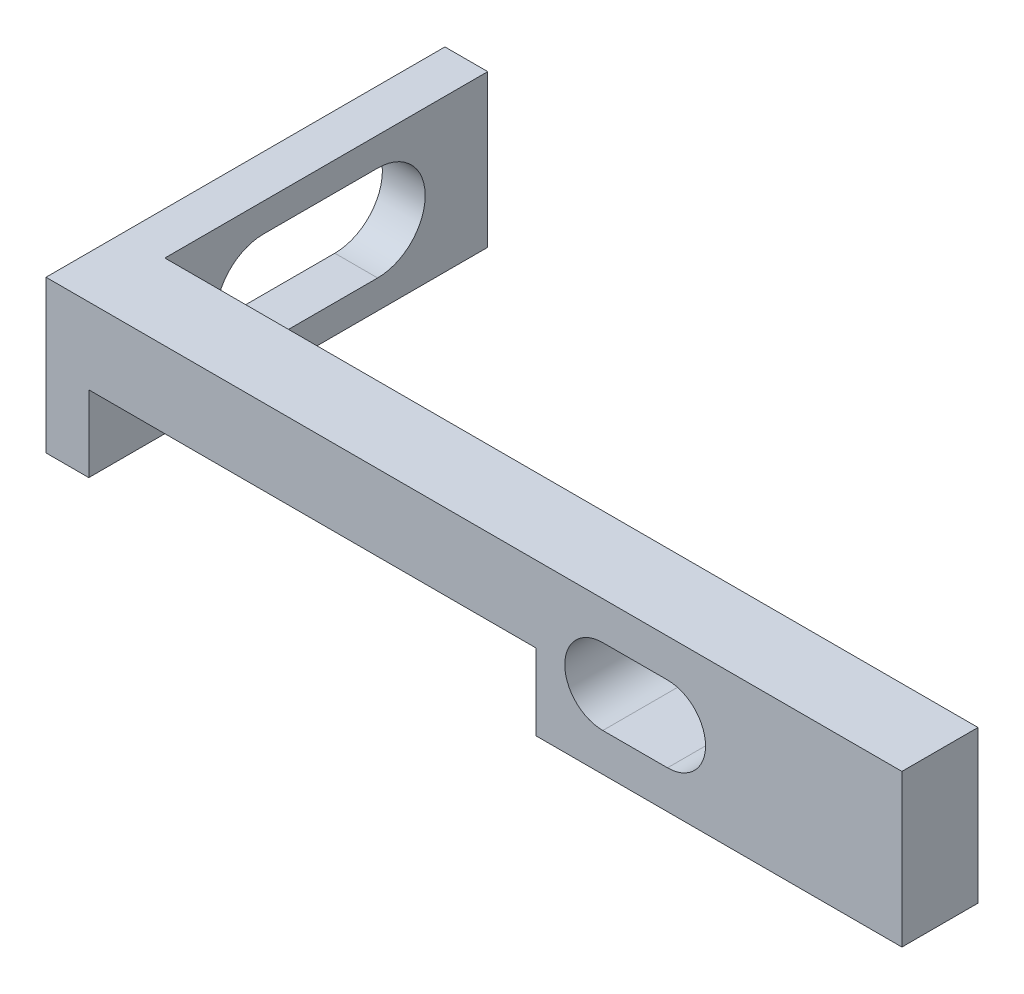
from build123d import *

# Parameters (mm, degrees)
SKETCH1_W           = 45
SKETCH1_H           = 25
BOSS_EXTRUDE1_DEPTH = 4
SKETCH5_W           = 40.5
SKETCH5_H           = 17
CUT_EXTRUDE2_DEPTH  = 27.048032555
SKETCH6_W           = 45
SKETCH6_H           = 4.025345596
CUT_EXTRUDE3_DEPTH  = 27.048032555
SKETCH13_W          = 2.25
SKETCH13_H          = 20.974654404
BOSS_EXTRUDE3_DEPTH = 8
SKETCH16_W          = 2.25
SKETCH16_H          = 20.974654404
BOSS_EXTRUDE4_DEPTH = 8
SKETCH19_W          = 17
SKETCH19_H          = 4
BOSS_EXTRUDE5_DEPTH = 4
SKETCH21_W          = 2.25
SKETCH21_H          = 16.974654404
CUT_EXTRUDE7_DEPTH  = 27.953663944
CUT_EXTRUDE9_DEPTH  = 47.874833333
CUT_EXTRUDE14_DEPTH = 32.019125187


with BuildPart() as part:
    # Sketch1 → Boss-Extrude1 (new body)
    with BuildSketch(Plane(origin=(0, 0, 0), x_dir=(1, 0, 0), z_dir=(0, 1, 0))):
        Rectangle(SKETCH1_W, SKETCH1_H)
    extrude(amount=BOSS_EXTRUDE1_DEPTH)

    # Sketch5 → Cut-Extrude2 (cut, through all)
    with BuildSketch(Plane(origin=(0, 4, 0), x_dir=(1, 0, 0), z_dir=(0, 1, 0))):
        Rectangle(SKETCH5_W, SKETCH5_H)
    extrude(amount=-CUT_EXTRUDE2_DEPTH, mode=Mode.SUBTRACT)

    # Sketch6 → Cut-Extrude3 (cut, through all)
    with BuildSketch(Plane(origin=(0, 4, 0), x_dir=(1, 0, 0), z_dir=(0, 1, 0))):
        with Locations((0, 10.487327202)):
            Rectangle(SKETCH6_W, SKETCH6_H)
    extrude(amount=-CUT_EXTRUDE3_DEPTH, mode=Mode.SUBTRACT)

    # Sketch13 → Boss-Extrude3 (add)
    with BuildSketch(Plane(origin=(0, 4, 0), x_dir=(1, 0, 0), z_dir=(0, 1, 0))):
        with Locations((21.375, -2.012672798)):
            Rectangle(SKETCH13_W, SKETCH13_H)
    extrude(amount=-BOSS_EXTRUDE3_DEPTH)

    # Sketch16 → Boss-Extrude4 (add)
    with BuildSketch(Plane(origin=(0, 4, 0), x_dir=(1, 0, 0), z_dir=(0, 1, 0))):
        with Locations((-21.375, -2.012672798)):
            Rectangle(SKETCH16_W, SKETCH16_H)
    extrude(amount=-BOSS_EXTRUDE4_DEPTH)

    # Sketch19 → Boss-Extrude5 (add)
    with BuildSketch(Plane.XZ):
        with Locations((11.75, 10.5)):
            Rectangle(SKETCH19_W, SKETCH19_H)
    extrude(amount=BOSS_EXTRUDE5_DEPTH)

    # Sketch21 → Cut-Extrude7 (cut, through all)
    with BuildSketch(Plane(origin=(0, 4, 0), x_dir=(1, 0, 0), z_dir=(0, 1, 0))):
        with Locations((21.375, -0.012672798)):
            Rectangle(SKETCH21_W, SKETCH21_H)
    extrude(amount=-CUT_EXTRUDE7_DEPTH, mode=Mode.SUBTRACT)

    # Sketch25 → Cut-Extrude9 (cut, through all)
    with BuildSketch(Plane.ZY.offset(22.5)):
        with BuildLine():
            Line((3.314549123, -2.5), (-2.685450877, -2.5))
            ThreePointArc((-2.685450877, -2.5), (-5.185450877, 0), (-2.685450877, 2.5))
            Line((-2.685450877, 2.5), (3.314549123, 2.5))
            ThreePointArc((3.314549123, 2.5), (5.814549123, 0), (3.314549123, -2.5))
        make_face()
    extrude(amount=-CUT_EXTRUDE9_DEPTH, mode=Mode.SUBTRACT)

    # Sketch29 → Cut-Extrude14 (cut, through all)
    with BuildSketch(Plane.XY.offset(12.5)):
        with BuildLine():
            Line((6.774762471, 2), (10.174762471, 2))
            ThreePointArc((10.174762471, 2), (12.174762471, 0), (10.174762471, -2))
            Line((10.174762471, -2), (6.774762471, -2))
            ThreePointArc((6.774762471, -2), (4.774762471, 0), (6.774762471, 2))
        make_face()
    extrude(amount=-CUT_EXTRUDE14_DEPTH, mode=Mode.SUBTRACT)


solid = part.part
